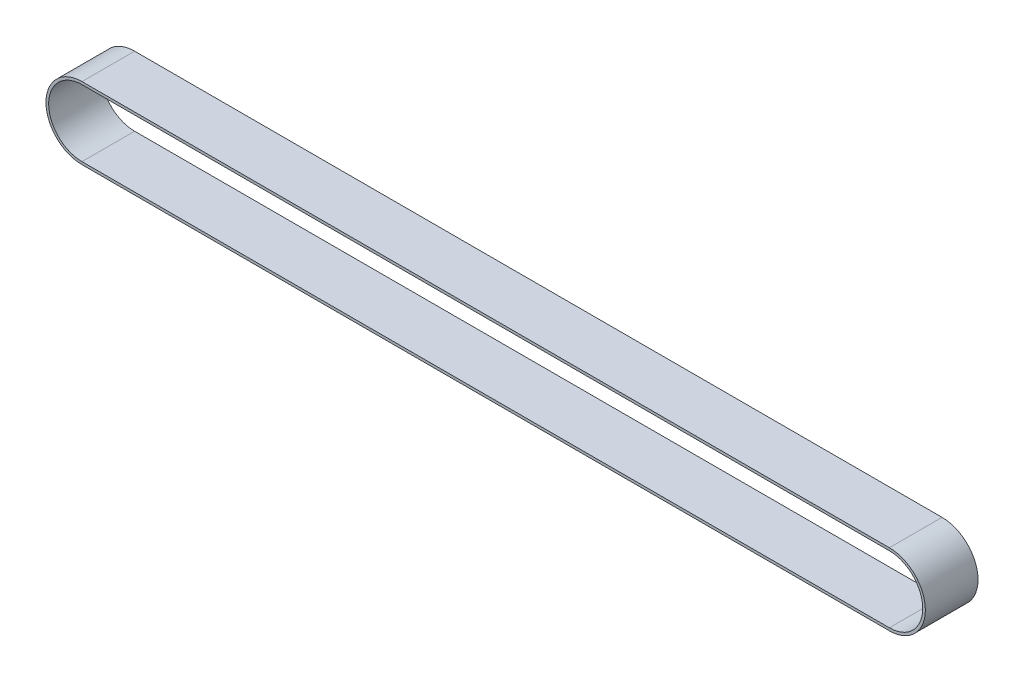
from build123d import *

# Parameters (mm, degrees)
EXTRUDE_1_DEPTH = 30


with BuildPart() as part:
    # 草图1 → 凸台-拉伸1 (new body)
    with BuildSketch(Plane.XY):
        with BuildLine():
            Line((0, 20.5), (460, 20.5))
            ThreePointArc((460, 20.5), (480.5, 0), (460, -20.5))
            Line((460, -20.5), (0, -20.5))
            ThreePointArc((0, -20.5), (-20.5, 0), (0, 20.5))
        make_face()
        with BuildLine():
            Line((0, 19), (460, 19))
            ThreePointArc((460, 19), (479, 0), (460, -19))
            Line((460, -19), (0, -19))
            ThreePointArc((0, -19), (-19, 0), (0, 19))
        make_face(mode=Mode.SUBTRACT)
    extrude(amount=EXTRUDE_1_DEPTH)


solid = part.part
